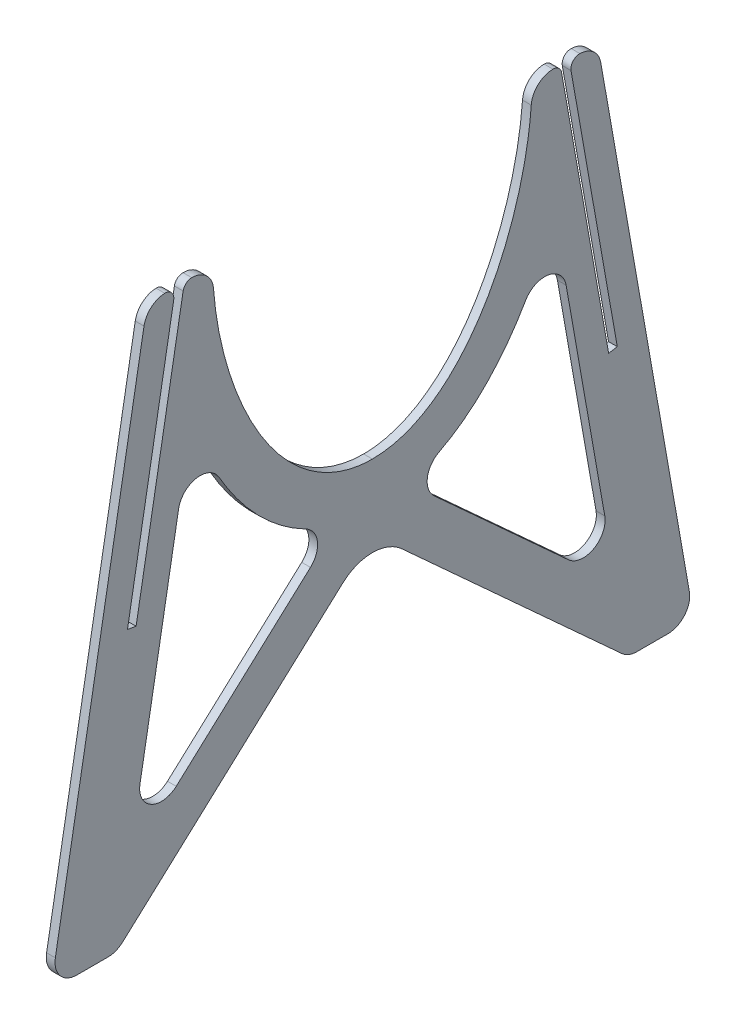
from build123d import *

# Parameters (mm, degrees)
BOSS_EXTRUDE1_DEPTH = 2
FILLET1_R           = 5
FILLET2_R           = 10
FILLET3_R           = 2


with BuildPart() as part:
    # Sketch1 → Boss-Extrude1 (new body)
    with BuildSketch(Plane(origin=(0, 0, 0), x_dir=(0, 0, -1), z_dir=(1, 0, 0))):
        with BuildLine():
            Line((-41.516169406, -28.395092982), (-36.509348393, 0))
            Line((-36.509348393, 0), (-42.993921781, 0))
            Line((-42.993921781, 0), (-45.348933305, -13.355934037))
            add(Edge.make_bspline(
                [(-41.516169406, -28.395092982), (-42.406047423, -25.822718457), (-43.663675234, -21.579570413), (-44.785881156, -16.527973462), (-45.22453792, -14.098106984), (-45.348933305, -13.355934037)],
                knots=[0.650991709, 0.650991709, 0.650991709, 0.650991709, 0.75, 0.8125, 0.839844015, 0.839844015, 0.839844015, 0.839844015], degree=3))
        make_face()
        with BuildLine():
            add(Edge.make_bspline(
                [(-36.734311328, -39.61313139), (-36.31166075, -5.335879915), (-36.509348393, -2.804764356), (-36.509348393, 0)],
                knots=[-0.125540923, -0.125540923, -0.125540923, -0.125540923, 0, 0, 0, 0], degree=3))
            Line((-36.509348393, 0), (-41.516169406, -28.395092982))
            add(Edge.make_bspline(
                [(-36.734311329, -39.61313139), (-38.291071594, -36.600576858), (-39.919107663, -32.86695786), (-41.282558157, -29.070394103), (-41.516169406, -28.395092982)],
                knots=[0.504435176, 0.504435176, 0.504435176, 0.504435176, 0.625, 0.650991709, 0.650991709, 0.650991709, 0.650991709], degree=3))
        make_face()
        with BuildLine():
            add(Edge.make_bspline(
                [(0, -56.582123974), (-0.15285504, -56.582123974), (-0.459015366, -56.579003354), (-0.9425664, -56.563848815), (-1.414530004, -56.539118181), (-1.886930027, -56.504103286), (-2.359700033, -56.458970207), (-2.832772658, -56.403580112), (-3.306079593, -56.337879287), (-3.779551581, -56.261794297), (-4.253118409, -56.17526026), (-4.726708901, -56.078213298), (-5.200250913, -55.970592632), (-5.673671325, -55.852340078), (-6.14689603, -55.723400256), (-6.619849964, -55.58372056), (-7.092456928, -55.433251348), (-7.564640259, -55.271945524), (-8.036320236, -55.099760311), (-8.507423832, -54.916650826), (-9.477122623, -54.516636949), (-10.948747336, -53.816609889), (-12.89260467, -52.689501524), (-14.839605061, -51.3452778), (-17.194882511, -49.440968842), (-19.979481326, -46.715634391), (-22.373510051, -43.796702563), (-24.214337196, -41.201788602), (-25.874947159, -38.63741395), (-27.780340987, -35.269902318), (-29.754772754, -31.147854655), (-31.504176856, -26.829930855), (-32.972797473, -22.48400564), (-34.216544224, -18.006531858), (-35.185072699, -13.616373053), (-35.763824039, -10.069443072), (-36.075264246, -7.549307147), (-36.236929808, -5.958492149), (-36.36050808, -4.408318684), (-36.446465449, -2.900229931), (-36.499793674, -1.324755215), (-36.509348393, -0.432584583), (-36.509348393, 0)],
                knots=[0, 0, 0, 0, 0.006411946, 0.012834426, 0.019269456, 0.025719095, 0.032185436, 0.038670605, 0.045176754, 0.051706059, 0.058260712, 0.064842919, 0.071454891, 0.078098844, 0.084776991, 0.091491538, 0.098244678, 0.105038588, 0.111875422, 0.118757308, 0.125686343, 0.154728737, 0.185249035, 0.217391809, 0.251290084, 0.308883385, 0.376236112, 0.405202202, 0.438841607, 0.501010386, 0.563124659, 0.625442554, 0.691233858, 0.750427507, 0.8152131, 0.874805779, 0.897171557, 0.91894884, 0.940127131, 0.960698431, 0.980657148, 1, 1, 1, 1], degree=3))
            add(Edge.make_bspline(
                [(-36.734311328, -39.61313139), (-36.31166075, -5.335879915), (-36.509348393, -2.804764356), (-36.509348393, 0)],
                knots=[-0.125540923, -0.125540923, -0.125540923, -0.125540923, 0, 0, 0, 0], degree=3))
            add(Edge.make_bspline(
                [(-25.467660531, -55.311957067), (-27.479030583, -53.331188436), (-31.695460978, -48.361330108), (-34.997159073, -42.955824776), (-36.677043332, -39.723953182), (-36.734311329, -39.61313139)],
                knots=[0.283252796, 0.283252796, 0.283252796, 0.283252796, 0.375, 0.5, 0.504435176, 0.504435176, 0.504435176, 0.504435176], degree=3))
            add(Edge.make_bspline(
                [(0, -56.582123974), (-3.658554228, -56.582123974), (-7.260215224, -55.688996917), (-25.467660531, -55.311957068)],
                knots=[1, 1, 1, 1, 1.153690207, 1.153690207, 1.153690207, 1.153690207], degree=3))
        make_face()
        with BuildLine():
            Line((-46.233798684, -55.150098143), (-41.516169406, -28.395092982))
            add(Edge.make_bspline(
                [(-41.516169406, -28.395092982), (-42.406047423, -25.822718457), (-43.663675234, -21.579570413), (-44.785881156, -16.527973462), (-45.22453792, -14.098106984), (-45.348933305, -13.355934037)],
                knots=[0.650991709, 0.650991709, 0.650991709, 0.650991709, 0.75, 0.8125, 0.839844015, 0.839844015, 0.839844015, 0.839844015], degree=3))
            Line((-45.348933305, -13.355934037), (-52.723424035, -55.178749245))
            add(Edge.make_bspline(
                [(-46.233798684, -55.150098143), (-48.294390095, -55.15448934), (-50.455713513, -55.163858539), (-52.723424035, -55.178749245)],
                knots=[1.199869651, 1.199869651, 1.199869651, 1.199869651, 1.211056862, 1.211056862, 1.211056862, 1.211056862], degree=3))
        make_face()
        with BuildLine():
            Line((0, -66.582123974), (0, -56.582123974))
            add(Edge.make_bspline(
                [(0, -56.582123974), (-3.658554228, -56.582123974), (-7.260215224, -55.688996917), (-25.467660531, -55.311957068)],
                knots=[1, 1, 1, 1, 1.153690207, 1.153690207, 1.153690207, 1.153690207], degree=3))
            add(Edge.make_bspline(
                [(-8.199476191, -65.52630943), (-8.730213995, -65.387732986), (-10.30787937, -64.933388324), (-13.86361038, -63.620640387), (-18.501666225, -61.127104015), (-22.553765159, -58.050612984), (-24.738660913, -56.029865527), (-25.467660531, -55.311957067)],
                knots=[0.078109146, 0.078109146, 0.078109146, 0.078109146, 0.093734146, 0.125, 0.1875, 0.25, 0.283252796, 0.283252796, 0.283252796, 0.283252796], degree=3))
            add(Edge.make_bspline(
                [(-1.5e-08, -66.582123974), (-2.209332858, -66.58212397), (-4.990457242, -66.293537639), (-7.668738388, -65.664885874), (-8.199476191, -65.52630943)],
                knots=[0, 0, 0, 0, 0.062484146, 0.078109146, 0.078109146, 0.078109146, 0.078109146], degree=3))
        make_face()
        with BuildLine():
            Line((-55.705474943, -108.866643511), (-46.233798684, -55.150098143))
            add(Edge.make_bspline(
                [(-46.233798684, -55.150098143), (-48.294390095, -55.15448934), (-50.455713513, -55.163858539), (-52.723424035, -55.178749245)],
                knots=[1.199869651, 1.199869651, 1.199869651, 1.199869651, 1.211056862, 1.211056862, 1.211056862, 1.211056862], degree=3))
            Line((-52.723424035, -55.178749245), (-54.044792455, -62.672601944))
            Line((-54.044792455, -62.672601944), (-55.029600208, -62.498953766))
            Line((-55.029600208, -62.498953766), (-66.049852023, -124.997907533))
            Line((-66.049852023, -124.997907533), (-58.549852023, -124.997907533))
            Line((-58.549852023, -124.997907533), (-55.705474943, -108.866643511))
        make_face()
        with BuildLine():
            Line((0, -71.582123974), (0, -66.582123974))
            add(Edge.make_bspline(
                [(-1.5e-08, -66.582123974), (-2.209332858, -66.58212397), (-4.990457242, -66.293537639), (-7.668738388, -65.664885874), (-8.199476191, -65.52630943)],
                knots=[0, 0, 0, 0, 0.062484146, 0.078109146, 0.078109146, 0.078109146, 0.078109146], degree=3))
            Line((-8.199476191, -65.52630943), (-37.498628899, -92.256303536))
            add(Edge.make_bspline(
                [(-37.721712425, -105.996127711), (-37.642614437, -101.193982556), (-37.56834762, -96.617734626), (-37.498628899, -92.256303536)],
                knots=[-0.180761369, -0.180761369, -0.180761369, -0.180761369, -0.17194755, -0.17194755, -0.17194755, -0.17194755], degree=3))
            Line((-37.721712425, -105.996127711), (0, -71.582123974))
        make_face()
        with BuildLine():
            Line((-46.205303368, -6.695109045), (-45.024775005, 0))
            Line((-45.024775005, 0), (-46.509348393, 0))
            add(Edge.make_bspline(
                [(-46.205303368, -6.695109045), (-46.246561401, -6.229724581), (-46.318750894, -5.32754172), (-46.403362629, -3.979416795), (-46.464477592, -2.606320976), (-46.502121457, -1.237066291), (-46.509348393, -0.420386564), (-46.509348393, 0)],
                knots=[0.920743505, 0.920743505, 0.920743505, 0.920743505, 0.9375, 0.953125, 0.96875, 0.984375, 1, 1, 1, 1], degree=3))
        make_face()
        with BuildLine():
            Line((-37.498628899, -92.256303536), (-55.705474943, -108.866643511))
            Line((-55.705474943, -108.866643511), (-58.549852023, -124.997907533))
            Line((-58.549852023, -124.997907533), (-37.721712425, -105.996127711))
            add(Edge.make_bspline(
                [(-37.721712425, -105.996127711), (-37.642614437, -101.193982556), (-37.56834762, -96.617734626), (-37.498628899, -92.256303536)],
                knots=[-0.180761369, -0.180761369, -0.180761369, -0.180761369, -0.17194755, -0.17194755, -0.17194755, -0.17194755], degree=3))
        make_face()
        with BuildLine():
            add(Edge.make_bspline(
                [(-46.205303368, -6.695109045), (-46.246561401, -6.229724581), (-46.318750894, -5.32754172), (-46.403362629, -3.979416795), (-46.464477592, -2.606320976), (-46.502121457, -1.237066291), (-46.509348393, -0.420386564), (-46.509348393, 0)],
                knots=[0.920743505, 0.920743505, 0.920743505, 0.920743505, 0.9375, 0.953125, 0.96875, 0.984375, 1, 1, 1, 1], degree=3))
            Line((-46.509348393, 0), (-51.509348393, 0))
            Line((-51.509348393, 0), (-61.252465206, -55.255961248))
            add(Edge.make_bspline(
                [(-54.756855641, -55.193371976), (-56.834847266, -55.209591156), (-58.998714893, -55.230325887), (-61.252465206, -55.255961248)],
                knots=[1.214354829, 1.214354829, 1.214354829, 1.214354829, 1.224328083, 1.224328083, 1.224328083, 1.224328083], degree=3))
            Line((-54.756855641, -55.193371976), (-46.205303368, -6.695109045))
        make_face()
        with BuildLine():
            Line((-56.014407961, -62.325305589), (-54.756855641, -55.193371976))
            add(Edge.make_bspline(
                [(-54.756855641, -55.193371976), (-56.834847266, -55.209591156), (-58.998714893, -55.230325887), (-61.252465206, -55.255961248)],
                knots=[1.214354829, 1.214354829, 1.214354829, 1.214354829, 1.224328083, 1.224328083, 1.224328083, 1.224328083], degree=3))
            Line((-61.252465206, -55.255961248), (-73.549852023, -124.997907533))
            Line((-73.549852023, -124.997907533), (-66.049852023, -124.997907533))
            Line((-66.049852023, -124.997907533), (-55.029600208, -62.498953766))
            Line((-55.029600208, -62.498953766), (-56.014407961, -62.325305589))
        make_face()
    extrude(amount=-BOSS_EXTRUDE1_DEPTH)

    # Fillet1
    fillet1_edges = [part.edges().sort_by_distance(p)[0] for p in [
        (-1, 0, 51.509348393),
        (-1, 0, 36.509348393),
        (-1, -28.395092982, 41.516169406),
        (-1, -124.997907533, 58.549852023),
        (-1, -124.997907533, 73.549852023),
        (-1, -108.866643511, 55.705474943),
        (-1, -65.52630943, 8.199476191),
    ]]
    fillet(fillet1_edges, radius=FILLET1_R)

    # Mirror2: part across plane


with BuildPart() as part_1:
    add(part.part)
    add(part.part.mirror(Plane(origin=(-2, 0, 0), x_dir=(1, 0, 0), z_dir=(0, 0, -1))))

    # Fillet2
    fillet2_edges = [part_1.edges().sort_by_distance(p)[0] for p in [
        (-1, -71.582123974, 0),
    ]]
    fillet(fillet2_edges, radius=FILLET2_R)

    # Fillet3
    fillet3_edges = [part_1.edges().sort_by_distance(p)[0] for p in [
        (-1, 0, 45.024775005),
        (-1, 0, 42.993921781),
        (-1, 0, -42.993921781),
        (-1, 0, -45.024775005),
    ]]
    fillet(fillet3_edges, radius=FILLET3_R)


solid = part_1.part
